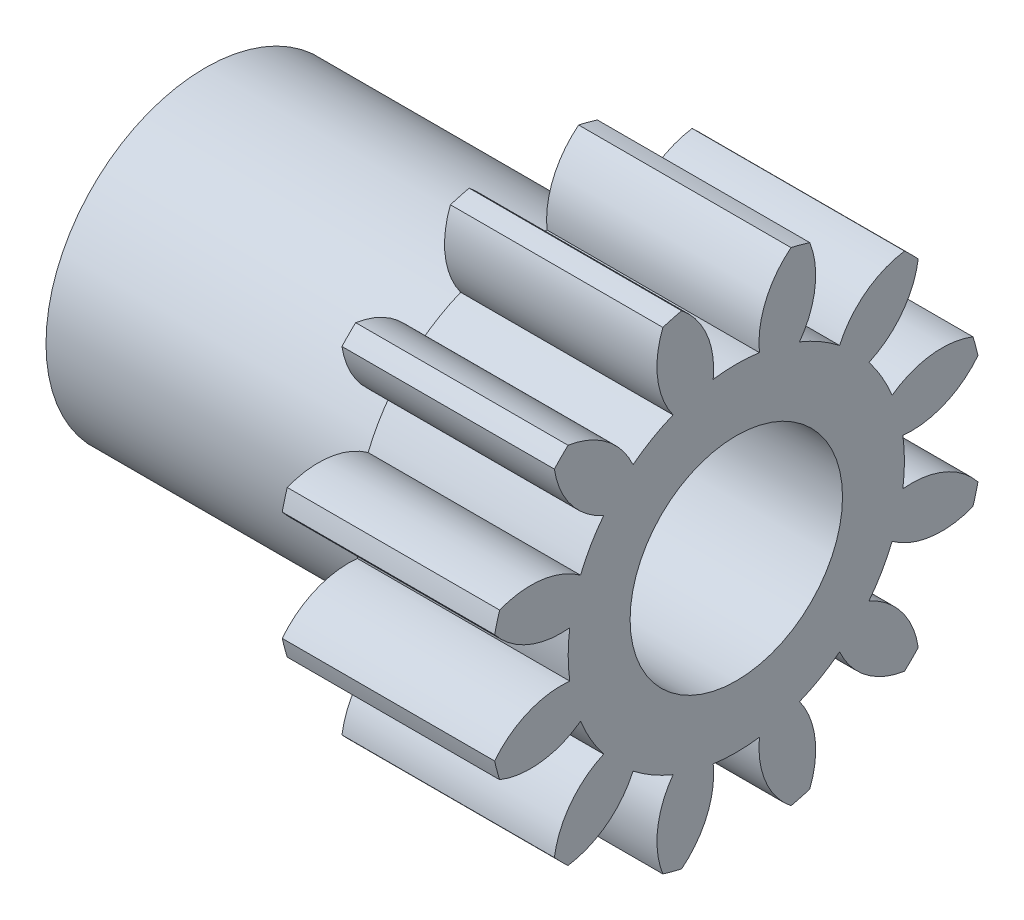
from build123d import *

# Parameters (mm, degrees)
BASPROSKE_W      = 12.7
BASPROSKE_H      = 14.816666667
TOOTHCUT_DEPTH   = 25.502188111
TEETHCUTS_COUNT  = 12
TEETHCUTS_ANGLE  = 330
HUBNEAONESKE_R   = 9.525
HUBNEARONE_DEPTH = 19.0500508
BORSKE_R         = 6.35
BORE_DEPTH       = 31.7500508


with BuildPart() as part:
    # BasProSke → Base-Revolve (revolve)
    with BuildSketch(Plane(origin=(0, 0, 0), x_dir=(1, 0, 0), z_dir=(0, 1, 0))):
        with Locations((6.35, 7.408333334)):
            Rectangle(BASPROSKE_W, BASPROSKE_H)
    revolve(axis=Axis((-10, 0, 0), (1, 0, 0)))

    # TooCutSke → ToothCut (cut, through all)
    with BuildSketch(Plane(origin=(0, 0, 0), x_dir=(0, 0, -1), z_dir=(1, 0, 0))):
        with BuildLine():
            ThreePointArc((1.381843105, 9.957471618), (0, 10.052896667), (-1.381843105, 9.957471618))
            ThreePointArc((-1.381843105, 9.957471618), (-1.758547944, 12.460702813), (-3.296530556, 14.471345108))
            ThreePointArc((-3.296530556, 14.471345108), (0, 14.842066667), (3.296530556, 14.471345108))
            ThreePointArc((3.296530556, 14.471345108), (1.758547944, 12.460702813), (1.381843105, 9.957471618))
        make_face()
    toothcut = extrude(amount=TOOTHCUT_DEPTH, mode=Mode.SUBTRACT)

    # TeethCuts: ToothCut ×12 about axis
    teethcuts_axis = Axis((-10, 0, 0), (1, 0, 0))
    for i in range(1, TEETHCUTS_COUNT):
        add(toothcut.rotate(teethcuts_axis, i * TEETHCUTS_ANGLE / (TEETHCUTS_COUNT - 1)), mode=Mode.SUBTRACT)

    # HubNeaOneSke → HubNearOne (add)
    with BuildSketch(Plane.ZY):
        Circle(HUBNEAONESKE_R)
    extrude(amount=HUBNEARONE_DEPTH)

    # BorSke → Bore (cut, symmetric)
    with BuildSketch(Plane(origin=(0, 0, 0), x_dir=(0, 0, -1), z_dir=(1, 0, 0))):
        Circle(BORSKE_R)
    extrude(amount=BORE_DEPTH, both=True, mode=Mode.SUBTRACT)


solid = part.part
